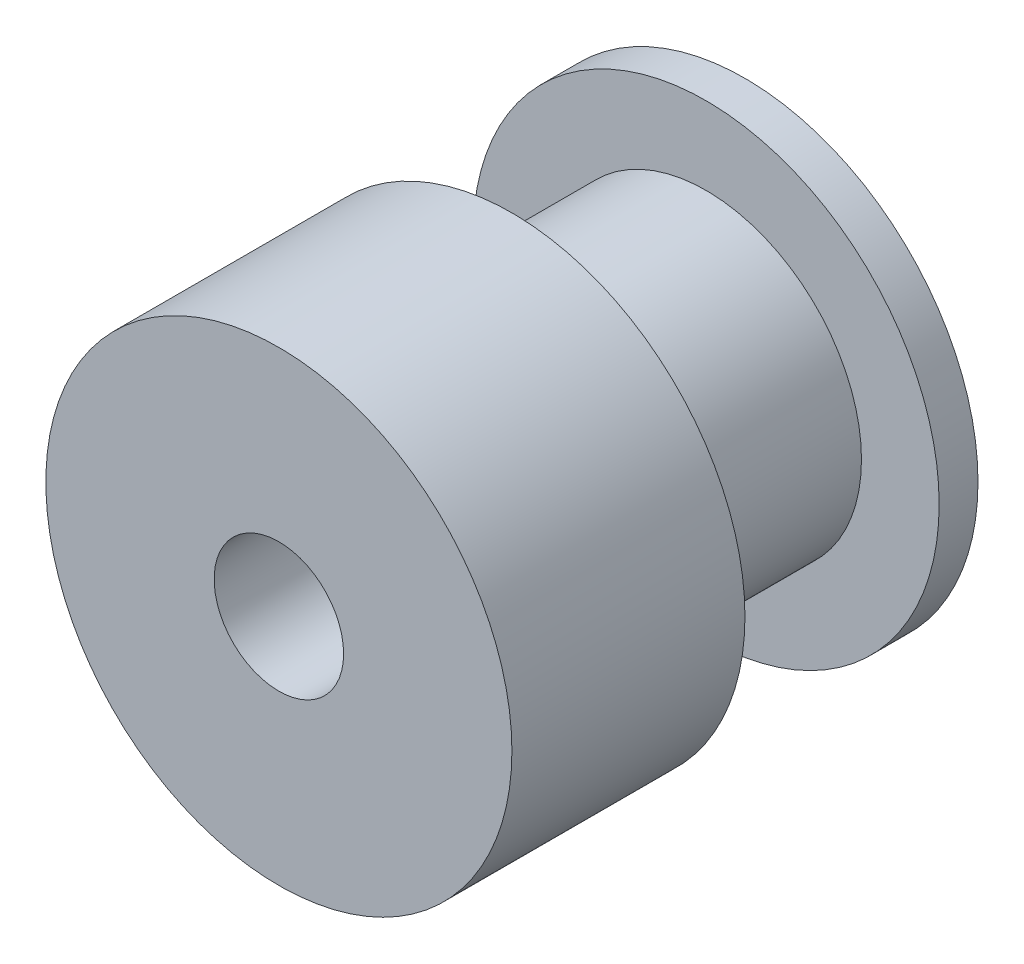
from build123d import *

# Parameters (mm, degrees)
ESQUISSE1_R                  = 9
BOSS_EXTRU_1_DEPTH           = 18
ENL_V_START                  = 1.5
ESQUISSE2_R                  = 9
ESQUISSE2_R_2                = 6
ENL_V_MAT_EXTRU_1_DEPTH      = 7.5
ESQUISSE3_R                  = 2.5
ENL_V_MAT_EXTRU_3_DEPTH      = 23.045407685
ESQUISSE4_R                  = 1.25
ENL_V_MAT_EXTRU_4_DEPTH      = 23.045407685
R_P_TITION_CIRCULAIRE1_COUNT = 2
R_P_TITION_CIRCULAIRE1_ANGLE = 90


with BuildPart() as part:
    # Esquisse1 → Boss.-Extru.1 (new body)
    with BuildSketch(Plane.XY):
        Circle(ESQUISSE1_R)
    extrude(amount=BOSS_EXTRU_1_DEPTH)

    # Esquisse2 → Enlèv. mat.-Extru.1 (cut)
    with BuildSketch(Plane.XY.offset(ENL_V_START)):
        Circle(ESQUISSE2_R)
        Circle(ESQUISSE2_R_2, mode=Mode.SUBTRACT)
    extrude(amount=ENL_V_MAT_EXTRU_1_DEPTH, mode=Mode.SUBTRACT)

    # Esquisse3 → Enlèv. mat.-Extru.3 (cut, through all)
    with BuildSketch(Plane.XY):
        Circle(ESQUISSE3_R)
    extrude(amount=ENL_V_MAT_EXTRU_3_DEPTH, mode=Mode.SUBTRACT)

    # Esquisse4 → Enlèv. mat.-Extru.4 (cut, through all)
    with BuildSketch(Plane(origin=(0, 0, 0), x_dir=(1, 0, 0), z_dir=(0, 1, 0))):
        with Locations(Location((0, -13.5, 0), (0, 0, 270))):
            Circle(ESQUISSE4_R)
    enl_v_mat_extru_4 = extrude(amount=-ENL_V_MAT_EXTRU_4_DEPTH, mode=Mode.SUBTRACT)

    # Répétition circulaire1: Enlèv. mat.-Extru.4 ×2 about axis
    r_p_tition_circulaire1_axis = Axis((0, 0, 18), (0, 0, -1))
    for i in range(1, R_P_TITION_CIRCULAIRE1_COUNT):
        add(enl_v_mat_extru_4.rotate(r_p_tition_circulaire1_axis, i * R_P_TITION_CIRCULAIRE1_ANGLE / (R_P_TITION_CIRCULAIRE1_COUNT - 1)), mode=Mode.SUBTRACT)


solid = part.part
